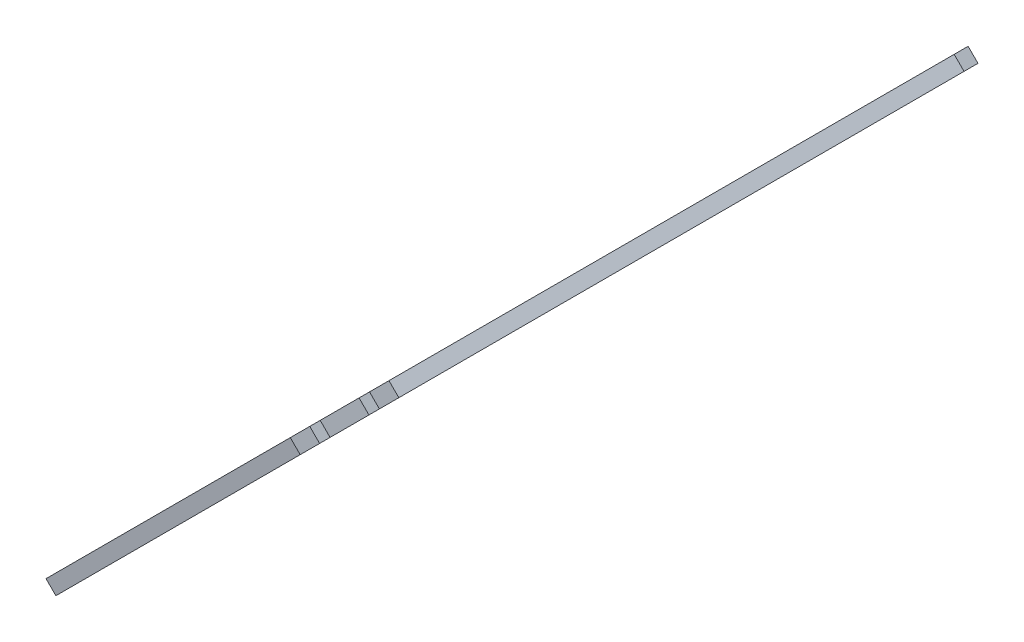
from build123d import *

# Parameters (mm, degrees)
BOSS_EXTRUDE1_DEPTH      = 5
BOSS_EXTRUDE1_DEPTH_BACK = 5
BODY_MOVE_COPY1_ANGLE    = 90
CUT_EXTRUDE2_DEPTH       = 708.325596879
CUT_EXTRUDE2_DEPTH_BACK  = 708.325596879
CUT_EXTRUDE3_DEPTH       = 30.3


with BuildPart() as part:
    # Sketch1 → Boss-Extrude1 (new, two sides: drawn at the far end of the back side and taken through both)
    with BuildSketch(Plane(origin=(164.5, 164.5, 0), x_dir=(-0.7071067811865478, 0.7071067811865475, 0), z_dir=(-0.7071067811865475, -0.7071067811865478, 0)).offset(-BOSS_EXTRUDE1_DEPTH_BACK)):
        Polygon((182.63813101, -115), (282.63813101, -115), (692.914393031, 0), (692.914393031, 10), (-227.63813101, 10), (-227.63813101, 0), align=None)
    extrude(amount=BOSS_EXTRUDE1_DEPTH + BOSS_EXTRUDE1_DEPTH_BACK)


with BuildPart() as part_1:
    # Body-Move/Copy1: moved
    add(part.part.moved(Location((0, 0, 0))).rotate(Axis((0, 329, 0), (0, 0, -1)), BODY_MOVE_COPY1_ANGLE))

    # Sketch2 → Cut-Extrude2 (cut, two sides: drawn at the far end of the back side and taken through both)
    with BuildSketch(Plane(origin=(-164.5, 164.5, 0), x_dir=(0.6804138174397739, 0.6804138174397697, 0.27216552697590835), z_dir=(-0.7071067811865454, 0.7071067811865498, 0)).offset(-CUT_EXTRUDE2_DEPTH_BACK)):
        Polygon((216.03456329, 71.496106715), (226.234418046, 74.381061301), (243.470750707, 13.992557954), (232.982220817, 11.02595371), align=None)
    extrude(amount=CUT_EXTRUDE2_DEPTH + CUT_EXTRUDE2_DEPTH_BACK, mode=Mode.SUBTRACT)

    # Sketch3 → Cut-Extrude3 (cut)
    with BuildSketch(Plane.XY.offset(115)):
        Polygon((-24.960869376, 311.110198436), (-17.889801564, 304.039130624), (-10.394469683, 311.534462505), (-17.465537495, 318.605530317), align=None)
        Polygon((10.394469683, 346.465537495), (17.465537495, 339.394469683), (24.960869376, 346.889801564), (17.889801564, 353.960869376), align=None)
    extrude(amount=-CUT_EXTRUDE3_DEPTH, mode=Mode.SUBTRACT)


solid = part_1.part
